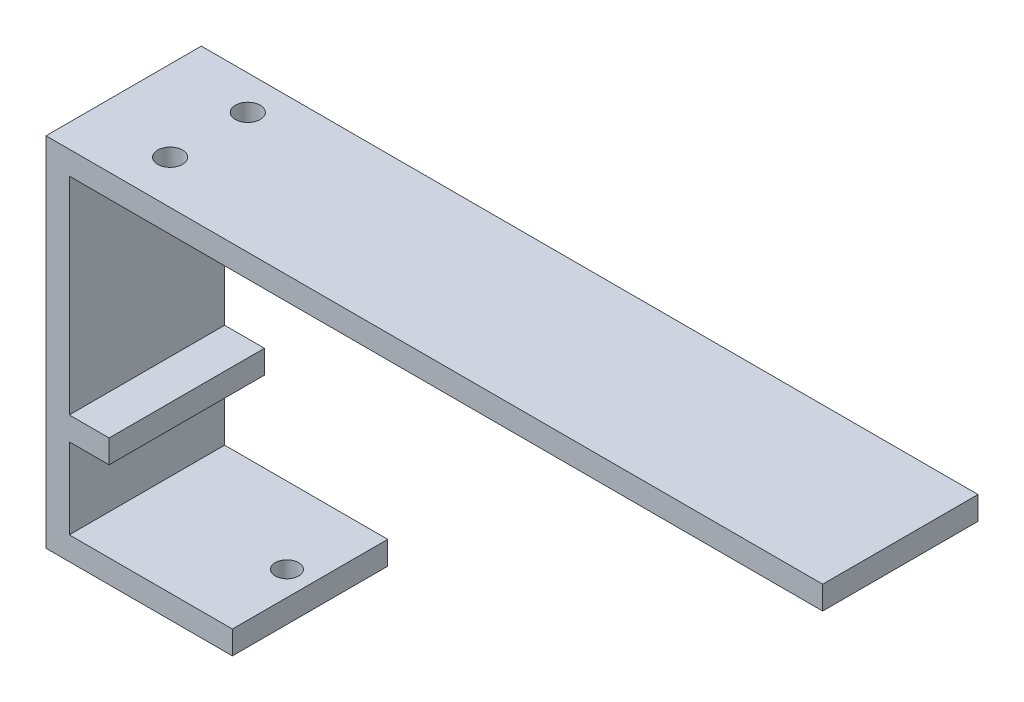
from build123d import *

# Parameters (mm, degrees)
SKETCH1_W            = 100
SKETCH1_H            = 20
BOSS_EXTRUDE1_DEPTH  = 3
BOSS_EXTRUDE3_DEPTH  = 20
SKETCH8_W            = 24
SKETCH8_H            = 3
BOSS_EXTRUDE6_DEPTH  = 20
SKETCH10_W           = 6
SKETCH10_H           = 3
BOSS_EXTRUDE9_DEPTH  = 20
SKETCH12_R           = 1.6
CUT_EXTRUDE1_DEPTH   = 80
SKETCH11_R           = 1.5
CUT_EXTRUDE2_DEPTH   = 20
SKETCH13_W           = 7.961309781
SKETCH13_H           = 15.301040779
BOSS_EXTRUDE10_DEPTH = 3


with BuildPart() as part:
    # Sketch1 → Boss-Extrude1 (new body)
    with BuildSketch(Plane(origin=(0, 0, 0), x_dir=(1, 0, 0), z_dir=(0, 1, 0))):
        with Locations((50, 10)):
            Rectangle(SKETCH1_W, SKETCH1_H)
    extrude(amount=BOSS_EXTRUDE1_DEPTH)

    # Sketch4 → Boss-Extrude3 (add)
    with BuildSketch(Plane(origin=(0, 0, -20), x_dir=(-1, 0, 0), z_dir=(0, 0, -1))):
        Polygon((0, -43), (0, 0), (-3, 0), (-3, -24), (-3, -26.692100843), (-3, -43), align=None)
    extrude(amount=-BOSS_EXTRUDE3_DEPTH)

    # Sketch8 → Boss-Extrude6 (add)
    with BuildSketch(Plane(origin=(0, 0, -20), x_dir=(-1, 0, 0), z_dir=(0, 0, -1))):
        with Locations((-12, -41.5)):
            Rectangle(SKETCH8_W, SKETCH8_H)
    extrude(amount=-BOSS_EXTRUDE6_DEPTH)

    # Sketch10 → Boss-Extrude9 (add)
    with BuildSketch(Plane.XY):
        with Locations((5.126533602, -28.13)):
            Rectangle(SKETCH10_W, SKETCH10_H)
    extrude(amount=-BOSS_EXTRUDE9_DEPTH)

    # Sketch12 → Cut-Extrude1 (cut)
    with BuildSketch(Plane(origin=(0, -43, 0), x_dir=(-1, 0, 0), z_dir=(0, -1, 0))):
        with Locations(Location((-10.38, 5.6, 0), (0, 0, 90))):
            Circle(SKETCH12_R)
        with Locations(Location((-10.38, 15.6, 0), (0, 0, 90))):
            Circle(SKETCH12_R)
    extrude(amount=-CUT_EXTRUDE1_DEPTH, mode=Mode.SUBTRACT)

    # Sketch11 → Cut-Extrude2 (cut)
    with BuildSketch(Plane.XZ.offset(43)):
        with Locations(Location((20.852680531, -10.165848845, 0), (0, 0, 270))):
            Circle(SKETCH11_R)
    extrude(amount=-CUT_EXTRUDE2_DEPTH, mode=Mode.SUBTRACT)

    # Sketch13 → Boss-Extrude10 (add)
    with BuildSketch(Plane.XZ.offset(43)):
        with Locations((9.051384729, -11.125007192)):
            Rectangle(SKETCH13_W, SKETCH13_H)
    extrude(amount=-BOSS_EXTRUDE10_DEPTH)


solid = part.part
